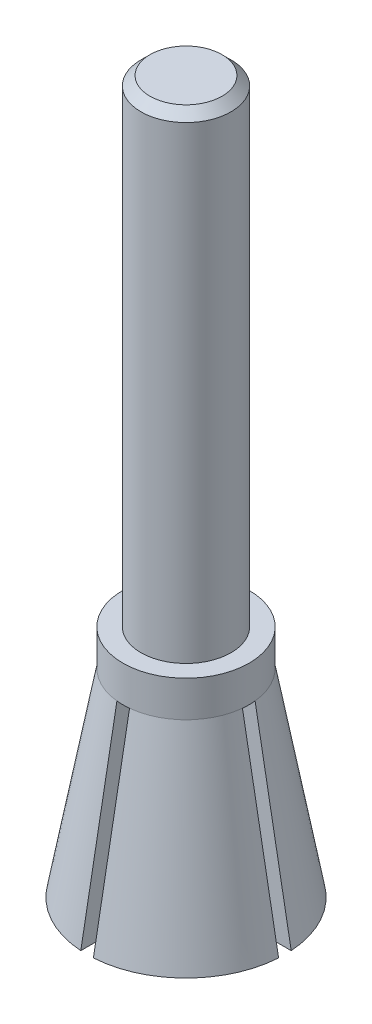
from build123d import *

# Parameters (mm, degrees)
SKETCH1_R           = 5.5
BOSS_EXTRUDE1_DEPTH = 11
BOSS_EXTRUDE1_TAPER = 10.3
SKETCH2_R           = 3.500961199
BOSS_EXTRUDE2_DEPTH = 2
SKETCH3_R           = 2.5
BOSS_EXTRUDE3_DEPTH = 26.5
CHAMFER1_SIZE       = 0.5
CUT_EXTRUDE1_DEPTH  = 11


with BuildPart() as part:
    # Sketch1 → Boss-Extrude1 (new body)
    with BuildSketch(Plane(origin=(0, 0, 0), x_dir=(1, 0, 0), z_dir=(0, 1, 0))):
        Circle(SKETCH1_R)
    extrude(amount=BOSS_EXTRUDE1_DEPTH, taper=BOSS_EXTRUDE1_TAPER)

    # Sketch2 → Boss-Extrude2 (add)
    with BuildSketch(Plane(origin=(0, 11, 0), x_dir=(1, 0, 0), z_dir=(0, 1, 0))):
        with Locations(Location((0, 0, 0), (0, 0, 270))):
            Circle(SKETCH2_R)
    extrude(amount=BOSS_EXTRUDE2_DEPTH)

    # Sketch3 → Boss-Extrude3 (add)
    with BuildSketch(Plane(origin=(0, 13, 0), x_dir=(1, 0, 0), z_dir=(0, 1, 0))):
        with Locations(Location((0, 0, 0), (0, 0, 270))):
            Circle(SKETCH3_R)
    extrude(amount=BOSS_EXTRUDE3_DEPTH)

    # Chamfer1
    chamfer1_edges = [part.edges().sort_by_distance(p)[0] for p in [
        (0, 39.5, -2.5),
    ]]
    chamfer(chamfer1_edges, length=CHAMFER1_SIZE)

    # Sketch4 → Cut-Extrude1 (cut)
    with BuildSketch(Plane.XZ):
        with BuildLine():
            Line((0.35, 5.488852339), (0.35, 1.969136867))
            ThreePointArc((0.35, 1.969136867), (1.414213562, 1.414213562), (1.969136867, 0.35))
            Line((1.969136867, 0.35), (5.488852339, 0.35))
            ThreePointArc((5.488852339, 0.35), (5.5, 0), (5.488852339, -0.35))
            Line((5.488852339, -0.35), (1.969136867, -0.35))
            ThreePointArc((1.969136867, -0.35), (1.414213562, -1.414213562), (0.35, -1.969136867))
            Line((0.35, -1.969136867), (0.35, -5.488852339))
            ThreePointArc((0.35, -5.488852339), (0, -5.5), (-0.35, -5.488852339))
            Line((-0.35, -5.488852339), (-0.35, -1.969136867))
            ThreePointArc((-0.35, -1.969136867), (-1.414213562, -1.414213562), (-1.969136867, -0.35))
            Line((-1.969136867, -0.35), (-5.488852339, -0.35))
            ThreePointArc((-5.488852339, -0.35), (-5.5, 0), (-5.488852339, 0.35))
            Line((-5.488852339, 0.35), (-1.969136867, 0.35))
            ThreePointArc((-1.969136867, 0.35), (-1.414213562, 1.414213562), (-0.35, 1.969136867))
            Line((-0.35, 1.969136867), (-0.35, 5.488852339))
            ThreePointArc((-0.35, 5.488852339), (0, 5.5), (0.35, 5.488852339))
        make_face()
    extrude(amount=-CUT_EXTRUDE1_DEPTH, mode=Mode.SUBTRACT)


solid = part.part
